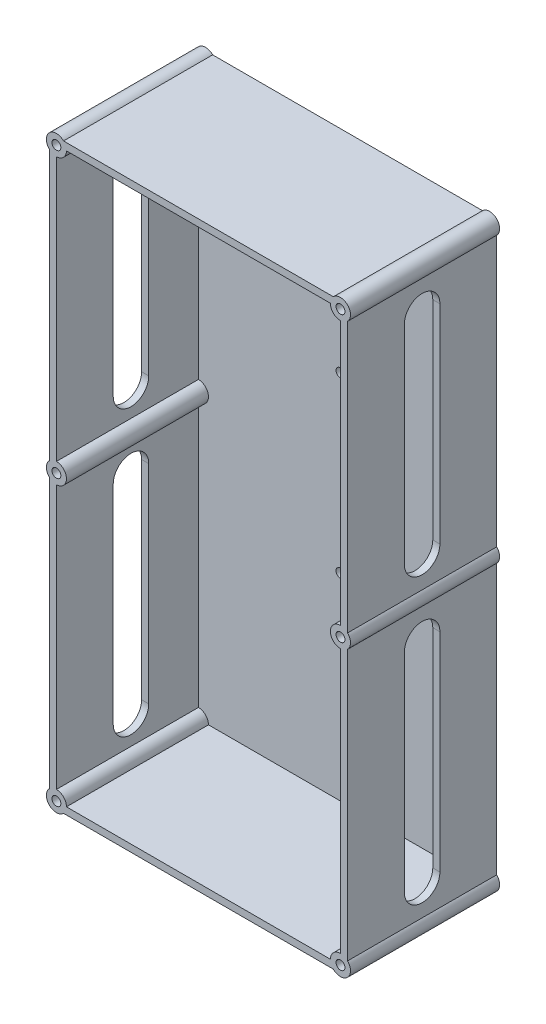
from build123d import *

# Parameters (mm, degrees)
SKETCH1_W           = 101.6
SKETCH1_H           = 203.2
BOSS_EXTRUDE1_DEPTH = 50.8
SHELL1_T            = 2.54
SKETCH2_R           = 1.5875
CUT_EXTRUDE1_DEPTH  = 50.8
BOSS_EXTRUDE2_REACH = 130.59
SKETCH3_R           = 3.592102448
SKETCH4_R           = 1.5875
CUT_EXTRUDE2_DEPTH  = 130.880848574
CUT_EXTRUDE3_DEPTH  = 159.909484662


with BuildPart() as part:
    # Sketch1 → Boss-Extrude1 (new body)
    with BuildSketch(Plane.XY):
        Rectangle(SKETCH1_W, SKETCH1_H)
    extrude(amount=BOSS_EXTRUDE1_DEPTH)

    # Shell1
    shell1_openings = [part.faces().sort_by_distance(p)[0] for p in [
        (0, 0, 50.8),
    ]]
    offset(amount=SHELL1_T, openings=shell1_openings, kind=Kind.INTERSECTION)

    # Sketch2 → Cut-Extrude1 (cut)
    with BuildSketch(Plane.XY):
        with Locations((0, 31.018508685)):
            Circle(SKETCH2_R)
        with Locations((0, -31.018508685)):
            Circle(SKETCH2_R)
    extrude(amount=-CUT_EXTRUDE1_DEPTH, mode=Mode.SUBTRACT)

    # Boss-Extrude2: up to this face of the body (flat: up to its plane)
    boss_extrude2_end = Plane(part.part.faces().sort_by_distance((0, 0, -2.54))[0])
    # Sketch3 → Boss-Extrude2 (add, up to the picked face)
    with BuildSketch(Plane.XY.offset(50.8), mode=Mode.PRIVATE) as boss_extrude2_sk1:
        with Locations((-50.8, 101.6)):
            Circle(SKETCH3_R)
    boss_extrude2_tool1 = split(extrude(boss_extrude2_sk1.sketch, amount=-BOSS_EXTRUDE2_REACH, mode=Mode.PRIVATE), bisect_by=boss_extrude2_end, keep=Keep.BOTH, mode=Mode.PRIVATE)
    # Sketch3 → Boss-Extrude2 (add, up to the picked face)
    with BuildSketch(Plane.XY.offset(50.8), mode=Mode.PRIVATE) as boss_extrude2_sk2:
        with Locations((50.8, 101.6)):
            Circle(SKETCH3_R)
    boss_extrude2_tool2 = split(extrude(boss_extrude2_sk2.sketch, amount=-BOSS_EXTRUDE2_REACH, mode=Mode.PRIVATE), bisect_by=boss_extrude2_end, keep=Keep.BOTH, mode=Mode.PRIVATE)
    # Sketch3 → Boss-Extrude2 (add, up to the picked face)
    with BuildSketch(Plane.XY.offset(50.8), mode=Mode.PRIVATE) as boss_extrude2_sk3:
        with Locations((50.8, -101.6)):
            Circle(SKETCH3_R)
    boss_extrude2_tool3 = split(extrude(boss_extrude2_sk3.sketch, amount=-BOSS_EXTRUDE2_REACH, mode=Mode.PRIVATE), bisect_by=boss_extrude2_end, keep=Keep.BOTH, mode=Mode.PRIVATE)
    # Sketch3 → Boss-Extrude2 (add, up to the picked face)
    with BuildSketch(Plane.XY.offset(50.8), mode=Mode.PRIVATE) as boss_extrude2_sk4:
        with Locations((-50.8, -101.6)):
            Circle(SKETCH3_R)
    boss_extrude2_tool4 = split(extrude(boss_extrude2_sk4.sketch, amount=-BOSS_EXTRUDE2_REACH, mode=Mode.PRIVATE), bisect_by=boss_extrude2_end, keep=Keep.BOTH, mode=Mode.PRIVATE)
    # Sketch3 → Boss-Extrude2 (add, up to the picked face)
    with BuildSketch(Plane.XY.offset(50.8), mode=Mode.PRIVATE) as boss_extrude2_sk5:
        with Locations((-50.8, 0)):
            Circle(SKETCH3_R)
    boss_extrude2_tool5 = split(extrude(boss_extrude2_sk5.sketch, amount=-BOSS_EXTRUDE2_REACH, mode=Mode.PRIVATE), bisect_by=boss_extrude2_end, keep=Keep.BOTH, mode=Mode.PRIVATE)
    # Sketch3 → Boss-Extrude2 (add, up to the picked face)
    with BuildSketch(Plane.XY.offset(50.8), mode=Mode.PRIVATE) as boss_extrude2_sk6:
        with Locations((50.8, 0)):
            Circle(SKETCH3_R)
    boss_extrude2_tool6 = split(extrude(boss_extrude2_sk6.sketch, amount=-BOSS_EXTRUDE2_REACH, mode=Mode.PRIVATE), bisect_by=boss_extrude2_end, keep=Keep.BOTH, mode=Mode.PRIVATE)
    add(boss_extrude2_tool1.solids().sort_by(Axis((-50.8, 101.6, 50.8), (0, 0, -1)))[0])
    add(boss_extrude2_tool2.solids().sort_by(Axis((50.8, 101.6, 50.8), (0, 0, -1)))[0])
    add(boss_extrude2_tool3.solids().sort_by(Axis((50.8, -101.6, 50.8), (0, 0, -1)))[0])
    add(boss_extrude2_tool4.solids().sort_by(Axis((-50.8, -101.6, 50.8), (0, 0, -1)))[0])
    add(boss_extrude2_tool5.solids().sort_by(Axis((-50.8, 0, 50.8), (0, 0, -1)))[0])
    add(boss_extrude2_tool6.solids().sort_by(Axis((50.8, 0, 50.8), (0, 0, -1)))[0])

    # Sketch4 → Cut-Extrude2 (cut, through all)
    with BuildSketch(Plane.XY.offset(50.8)):
        with Locations((-50.8, 0)):
            Circle(SKETCH4_R)
        with Locations((50.8, 0)):
            Circle(SKETCH4_R)
        with Locations((50.8, 101.6)):
            Circle(SKETCH4_R)
        with Locations((-50.8, 101.6)):
            Circle(SKETCH4_R)
        with Locations((50.8, -101.6)):
            Circle(SKETCH4_R)
        with Locations((-50.8, -101.6)):
            Circle(SKETCH4_R)
    extrude(amount=-CUT_EXTRUDE2_DEPTH, mode=Mode.SUBTRACT)

    # Sketch5 → Cut-Extrude3 (cut, through all)
    with BuildSketch(Plane(origin=(53.34, 0, 0), x_dir=(0, 0, -1), z_dir=(1, 0, 0))):
        with BuildLine():
            Line((-17.78, 88.01360889), (-17.78, 13.58639111))
            ThreePointArc((-17.78, 13.58639111), (-24.13, 7.23639111), (-30.48, 13.58639111))
            Line((-30.48, 13.58639111), (-30.48, 88.01360889))
            ThreePointArc((-30.48, 88.01360889), (-24.13, 94.36360889), (-17.78, 88.01360889))
        make_face()
    cut_extrude3 = extrude(amount=-CUT_EXTRUDE3_DEPTH, mode=Mode.SUBTRACT)

    # Mirror1: Cut-Extrude3 across plane
    add(cut_extrude3.mirror(Plane.ZX), mode=Mode.SUBTRACT)


solid = part.part
